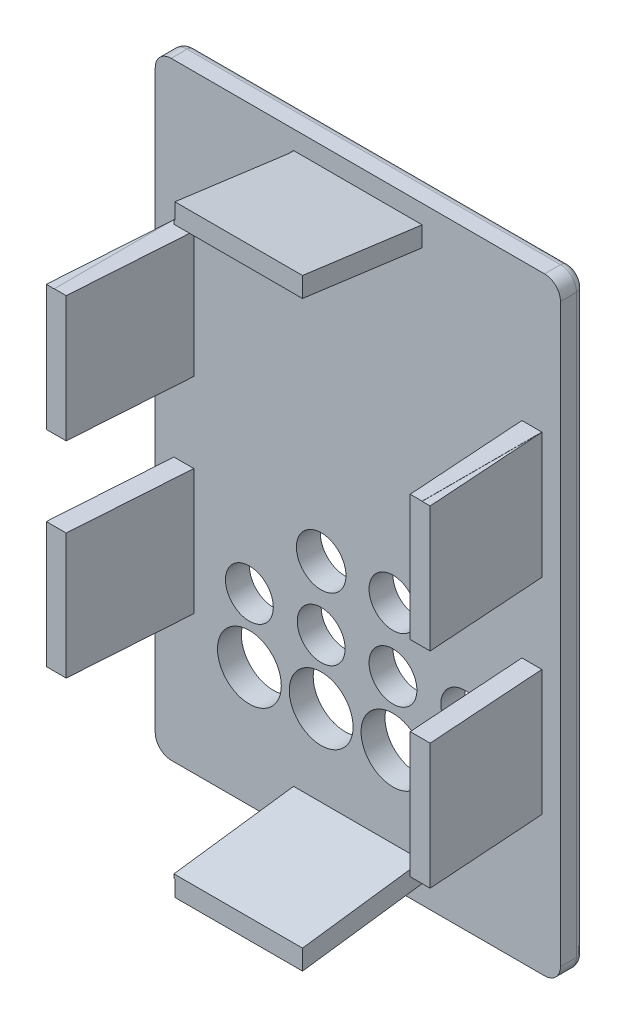
from build123d import *

# Parameters (mm, degrees)
CROQUIS1_W              = 50.8
CROQUIS1_H              = 76.2
SALIENTE_EXTRUIR1_DEPTH = 18
CROQUIS2_W              = 50.8
CROQUIS2_H              = 76.2
CROQUIS2_W_2            = 46.12
CROQUIS2_H_2            = 71.52
CROQUIS2_W_3            = 38.8
CROQUIS2_H_3            = 64.2
CORTAR_EXTRUIR1_DEPTH   = 15
CORTAR_EXTRUIR8_DEPTH   = 15
SALIENTE_EXTRUIR3_DEPTH = 41.5
CORTAR_EXTRUIR9_DEPTH   = 51.5
CORTAR_EXTRUIR10_DEPTH  = 51.5
SALIENTE_EXTRUIR4_DEPTH = 16
CORTAR_EXTRUIR11_DEPTH  = 16.5
REDONDEO3_R             = 2
REDONDEO4_R             = 1
CROQUIS15_W             = 48.12
CROQUIS15_H             = 10
CORTAR_EXTRUIR12_DEPTH  = 15
CROQUIS16_W             = 8
CROQUIS16_H             = 1.5
CORTAR_EXTRUIR13_DEPTH  = 2
CROQUIS17_R             = 4
CROQUIS17_R_2           = 3
CROQUIS17_R_3           = 3.105135185
CROQUIS17_R_4           = 3.001630679
CORTAR_EXTRUIR14_DEPTH  = 10


with BuildPart() as part:
    # Croquis1 → Saliente-Extruir1 (new body)
    with BuildSketch(Plane.XY):
        Rectangle(CROQUIS1_W, CROQUIS1_H)
    extrude(amount=SALIENTE_EXTRUIR1_DEPTH)

    # Croquis2 → Cortar-Extruir1 (cut)
    # profile 1 of 2: a face of its own
    with BuildSketch(Plane.XY.offset(18)):
        Rectangle(CROQUIS2_W, CROQUIS2_H)
        Rectangle(CROQUIS2_W_2, CROQUIS2_H_2, mode=Mode.SUBTRACT)
    # profile 2 of 2: a face of its own
    with BuildSketch(Plane.XY.offset(18)):
        Rectangle(CROQUIS2_W_3, CROQUIS2_H_3)
    extrude(amount=-CORTAR_EXTRUIR1_DEPTH, mode=Mode.SUBTRACT)

    # Croquis6 → Cortar-Extruir8 (cut)
    with BuildSketch(Plane.XY.offset(18)):
        Polygon((-23.06, 35.76), (-8.06, 35.76), (-8.06, 32.1), (-19.4, 32.1), (-19.4, 20.76), (-23.06, 20.76), align=None)
        Polygon((23.06, 35.76), (8.06, 35.76), (8.06, 32.1), (19.4, 32.1), (19.4, 20.76), (23.06, 20.76), align=None)
        Polygon((-23.06, -35.76), (-23.06, -20.76), (-19.4, -20.76), (-19.4, -32.1), (-8.06, -32.1), (-8.06, -35.76), align=None)
        Polygon((23.06, -35.76), (8.06, -35.76), (8.06, -32.1), (19.4, -32.1), (19.4, -20.76), (23.06, -20.76), align=None)
    extrude(amount=-CORTAR_EXTRUIR8_DEPTH, mode=Mode.SUBTRACT)

    # Croquis10 → Saliente-Extruir3 (add)
    with BuildSketch(Plane(origin=(0, -20.76, 0), x_dir=(-1, 0, 0), z_dir=(0, -1, 0))):
        Polygon((23.06, -18), (24.06, -18), (23.06, -3), align=None)
        Polygon((-23.06, -18), (-24.06, -18), (-23.06, -3), align=None)
    extrude(amount=-SALIENTE_EXTRUIR3_DEPTH)

    # Croquis11 → Cortar-Extruir9 (cut)
    with BuildSketch(Plane.XZ.offset(20.76)):
        Polygon((-19.4, 18), (-21.56, 18), (-20.56, 3), (-19.4, 3), align=None)
    extrude(amount=-CORTAR_EXTRUIR9_DEPTH, mode=Mode.SUBTRACT)

    # Croquis12 → Cortar-Extruir10 (cut)
    with BuildSketch(Plane.XZ.offset(20.76)):
        Polygon((19.4, 18), (19.4, 3), (20.56, 3), (21.56, 18), align=None)
    extrude(amount=-CORTAR_EXTRUIR10_DEPTH, mode=Mode.SUBTRACT)

    # Croquis13 → Saliente-Extruir4 (add)
    with BuildSketch(Plane(origin=(8.06, 0, 0), x_dir=(0, 0, -1), z_dir=(1, 0, 0))):
        Polygon((-18, -35.76), (-18, -37.76), (-3, -35.76), align=None)
        Polygon((-18, 35.76), (-18, 37.76), (-3, 35.76), align=None)
    extrude(amount=-SALIENTE_EXTRUIR4_DEPTH)

    # Croquis14 → Cortar-Extruir11 (cut)
    with BuildSketch(Plane(origin=(8.06, 0, 0), x_dir=(0, 0, -1), z_dir=(1, 0, 0))):
        Polygon((-3, -32.1), (-18, -32.1), (-18, -35.26), (-3, -33.26), align=None)
        Polygon((-18, 32.1), (-18, 35.26), (-3, 33.26), (-3, 32.1), align=None)
    extrude(amount=-CORTAR_EXTRUIR11_DEPTH, mode=Mode.SUBTRACT)

    # Redondeo3
    redondeo3_edges = [part.edges().sort_by_distance(p)[0] for p in [
        (-25.4, 38.1, 1.5),
        (25.4, 38.1, 1.5),
        (25.4, -38.1, 1.5),
        (-25.4, -38.1, 1.5),
    ]]
    fillet(redondeo3_edges, radius=REDONDEO3_R)

    # Redondeo4
    redondeo4_edges = [part.edges().sort_by_distance(p)[0] for p in [
        (0, 38.1, 0),
        (-25.4, 0, 0),
        (25.4, 0, 0),
        (0, -38.1, 0),
        (24.814213562, -37.514213562, 0),
        (-24.814213562, -37.514213562, 0),
        (-24.814213562, 37.514213562, 0),
        (24.814213562, 37.514213562, 0),
    ]]
    fillet(redondeo4_edges, radius=REDONDEO4_R)

    # Croquis15 → Cortar-Extruir12 (cut)
    with BuildSketch(Plane.XY.offset(18)):
        with Locations((0, -0.01)):
            Rectangle(CROQUIS15_W, CROQUIS15_H)
    extrude(amount=-CORTAR_EXTRUIR12_DEPTH, mode=Mode.SUBTRACT)

    # Croquis16 → Cortar-Extruir13 (cut)
    with BuildSketch(Plane.XZ.offset(38.1)):
        with Locations((0, 2.25)):
            Rectangle(CROQUIS16_W, CROQUIS16_H)
    extrude(amount=-CORTAR_EXTRUIR13_DEPTH, mode=Mode.SUBTRACT)

    # Croquis17 → Cortar-Extruir14 (cut)
    with BuildSketch(Plane.XY.offset(3)):
        with Locations((13.4, -23.1)):
            Circle(CROQUIS17_R)
        with Locations((13.4, -15.1)):
            Circle(CROQUIS17_R_2)
        with Locations((4.4, -23.1)):
            Circle(CROQUIS17_R)
        with Locations((-4.6, -23.1)):
            Circle(CROQUIS17_R)
        with Locations((-13.6, -23.1)):
            Circle(CROQUIS17_R)
        with Locations((4.4, -15.1)):
            Circle(CROQUIS17_R_2)
        with Locations((-4.6, -15.1)):
            Circle(CROQUIS17_R_2)
        with Locations((-13.6, -15.1)):
            Circle(CROQUIS17_R_2)
        with Locations((-4.6, -7.1)):
            Circle(CROQUIS17_R_3)
        with Locations((4.4, -7.1)):
            Circle(CROQUIS17_R_4)
    extrude(amount=-CORTAR_EXTRUIR14_DEPTH, mode=Mode.SUBTRACT)


solid = part.part
